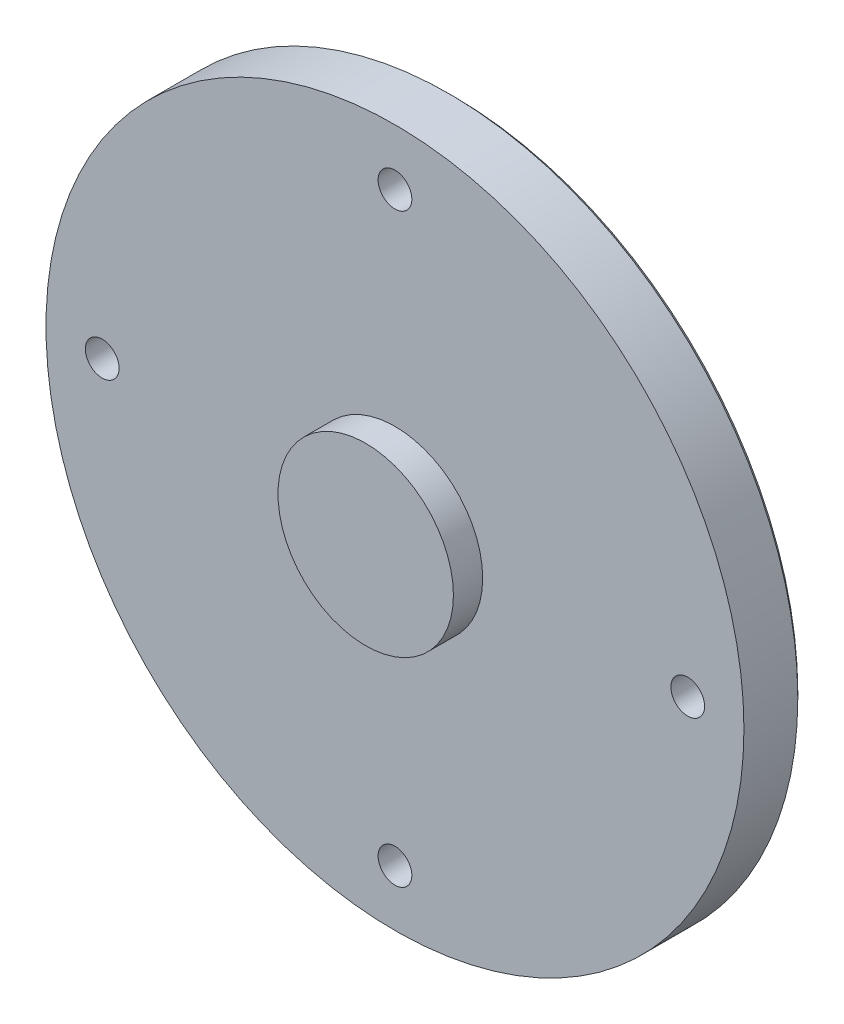
from build123d import *

# Parameters (mm, degrees)
CBORE_FOR_6_SOCKET_HEAD_CAP_SCREW1_D           = 3.6576
CBORE_FOR_6_SOCKET_HEAD_CAP_SCREW1_CBORE_D     = 7.14502
CBORE_FOR_6_SOCKET_HEAD_CAP_SCREW1_CBORE_DEPTH = 3.5052
CHAMFER1_SIZE                                  = 0.508


with BuildPart() as part:
    # Sketch1 → Revolve1 (revolve)
    with BuildSketch(Plane(origin=(0, 0, 0), x_dir=(0, 0, -1), z_dir=(1, 0, 0)), mode=Mode.PRIVATE) as revolve1_sk:
        Polygon((-22.225, 0), (-22.225, 9.5123), (-19.05, 9.5123), (-19.05, 37.846), (-12.7, 37.846), (-12.7, 12.6492), (0, 12.6492), (0, 0), align=None)
    revolve(revolve1_sk.sketch.rotate(Axis((0, 0, 22.225), (0, 0, -1)), 90), axis=Axis((0, 0, 22.225), (0, 0, -1)))

    # CBORE for #6 Socket Head Cap Screw1 (through all)
    with Locations(Plane(origin=(0, 0, 12.7), x_dir=(-1, 0, 0), z_dir=(0, 0, -1))):
        with Locations((-31.75, 0), (0, 31.75), (31.75, 0), (0, -31.75)):
            CounterBoreHole(CBORE_FOR_6_SOCKET_HEAD_CAP_SCREW1_D / 2, CBORE_FOR_6_SOCKET_HEAD_CAP_SCREW1_CBORE_D / 2, CBORE_FOR_6_SOCKET_HEAD_CAP_SCREW1_CBORE_DEPTH)

    # Chamfer1
    chamfer1_edges = [part.edges().sort_by_distance(p)[0] for p in [
        (-12.6492, 0, 0),
        (-37.846, 0, 12.7),
    ]]
    chamfer(chamfer1_edges, length=CHAMFER1_SIZE)


solid = part.part
